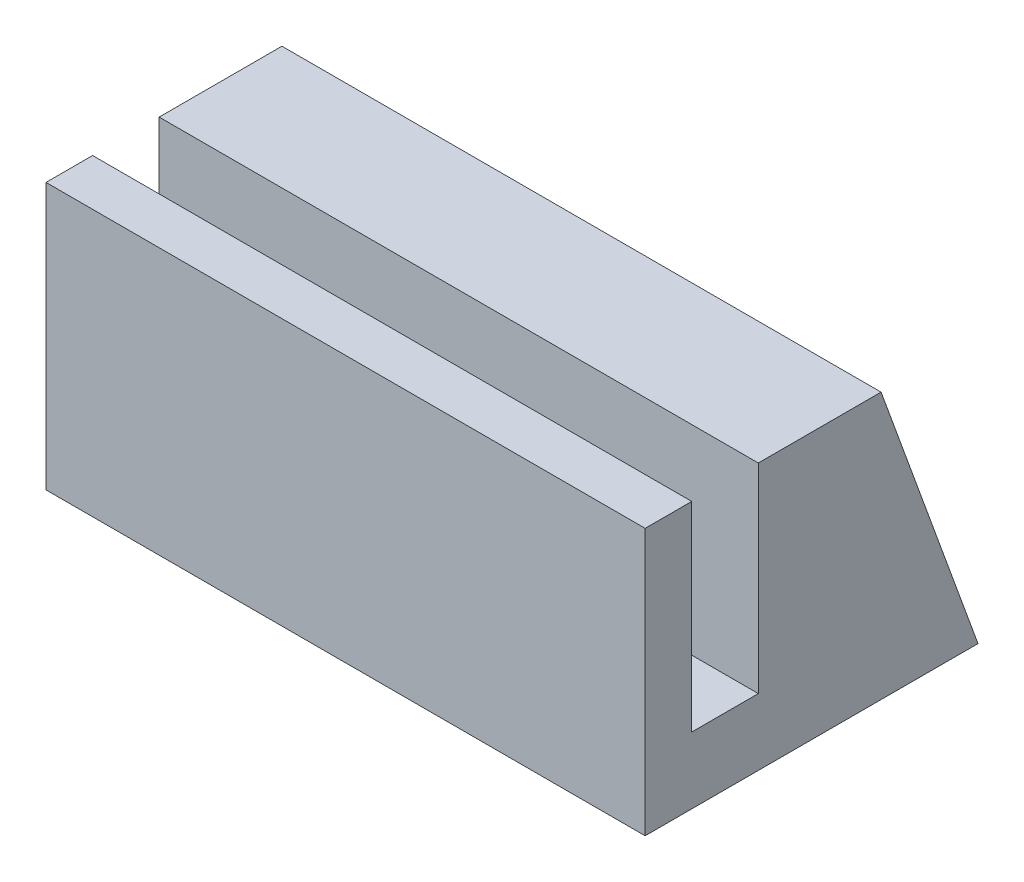
from build123d import *

# Parameters (mm, degrees)
SKETCH2_W           = 45
SKETCH2_H           = 20
BOSS_EXTRUDE1_DEPTH = 25
SKETCH5_W           = 45
SKETCH5_H           = 5
CUT_EXTRUDE1_DEPTH  = 15
CUT_EXTRUDE2_DEPTH  = 45
SKETCH8_W           = 38.3
SKETCH8_H           = 9.6
CUT_EXTRUDE3_DEPTH  = 10


with BuildPart() as part:
    # Sketch2 → Boss-Extrude1 (new body)
    with BuildSketch(Plane.XY):
        Rectangle(SKETCH2_W, SKETCH2_H)
    extrude(amount=BOSS_EXTRUDE1_DEPTH)

    # Sketch5 → Cut-Extrude1 (cut)
    with BuildSketch(Plane(origin=(0, 10, 0), x_dir=(1, 0, 0), z_dir=(0, 1, 0))):
        with Locations((0, -19)):
            Rectangle(SKETCH5_W, SKETCH5_H)
    extrude(amount=-CUT_EXTRUDE1_DEPTH, mode=Mode.SUBTRACT)

    # Sketch7 → Cut-Extrude2 (cut)
    with BuildSketch(Plane(origin=(22.5, 0, 0), x_dir=(0, 0, -1), z_dir=(1, 0, 0))):
        Polygon((0, -10), (0, 10), (-7.28, 10), align=None)
    extrude(amount=-CUT_EXTRUDE2_DEPTH, mode=Mode.SUBTRACT)

    # Sketch8 → Cut-Extrude3 (cut)
    with BuildSketch(Plane(origin=(0, -1.169946737, 3.214139388), x_dir=(-1, 0, 0), z_dir=(0, 0.34204484166827, -0.9396836309567855))):
        Rectangle(SKETCH8_W, SKETCH8_H)
    extrude(amount=-CUT_EXTRUDE3_DEPTH, mode=Mode.SUBTRACT)


solid = part.part
